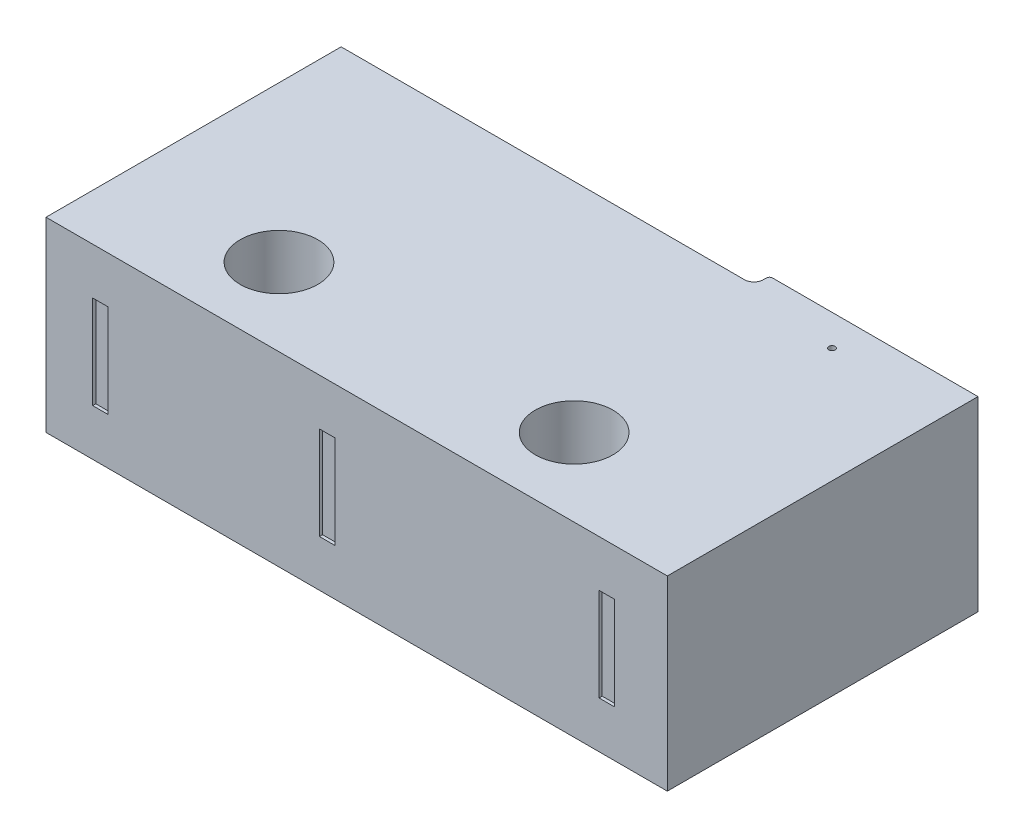
from build123d import *

# Parameters (mm, degrees)
SALIENTE_EXTRUIR2_DEPTH = 6
CROQUIS2_R              = 1.25
CORTAR_EXTRUIR1_DEPTH   = 10
REDONDEO1_R             = 0.1
CROQUIS3_W              = 2
CROQUIS3_H              = 3.3
CORTAR_EXTRUIR2_DEPTH   = 5
CROQUIS4_R              = 0.1
CORTAR_EXTRUIR3_DEPTH   = 6
CROQUIS5_W              = 0.5
CROQUIS5_H              = 3
CORTAR_EXTRUIR4_DEPTH   = 0.1


with BuildPart() as part:
    # Croquis1 → Saliente-Extruir2 (new body)
    with BuildSketch(Plane(origin=(0, 0, 0), x_dir=(1, 0, 0), z_dir=(0, 1, 0))):
        with BuildLine():
            Line((2.986733927, 4.5), (-10, 4.5))
            Line((-10, 4.5), (-10, -5))
            Line((-10, -5), (10, -5))
            Line((10, -5), (10, 5))
            Line((10, 5), (3.286733927, 5))
            Line((3.286733927, 5), (3.286733927, 4.8))
            ThreePointArc((3.286733927, 4.8), (3.198865961, 4.587867966), (2.986733927, 4.5))
        make_face()
    extrude(amount=SALIENTE_EXTRUIR2_DEPTH)

    # Croquis2 → Cortar-Extruir1 (cut)
    with BuildSketch(Plane(origin=(0, 6, 0), x_dir=(1, 0, 0), z_dir=(0, 1, 0))):
        with Locations(Location((-5, -2.5, 0), (0, 0, 270))):
            Circle(CROQUIS2_R)
        with Locations(Location((4.5, -2.5, 0), (0, 0, 270))):
            Circle(CROQUIS2_R)
    extrude(amount=-CORTAR_EXTRUIR1_DEPTH, mode=Mode.SUBTRACT)

    # Redondeo1
    redondeo1_edges = [part.edges().sort_by_distance(p)[0] for p in [
        (3.286733927, 3, -5),
    ]]
    fillet(redondeo1_edges, radius=REDONDEO1_R)

    # Croquis3 → Cortar-Extruir2 (cut)
    with BuildSketch(Plane(origin=(0, 0, -4.5), x_dir=(-1, 0, 0), z_dir=(0, 0, -1))):
        with Locations((-0.386733927, 3)):
            Rectangle(CROQUIS3_W, CROQUIS3_H)
    extrude(amount=-CORTAR_EXTRUIR2_DEPTH, mode=Mode.SUBTRACT)

    # Croquis4 → Cortar-Extruir3 (cut)
    with BuildSketch(Plane(origin=(0, 6, 0), x_dir=(1, 0, 0), z_dir=(0, 1, 0))):
        with Locations(Location((6.3, 4, 0), (0, 0, 270))):
            Circle(CROQUIS4_R)
    extrude(amount=-CORTAR_EXTRUIR3_DEPTH, mode=Mode.SUBTRACT)

    # Croquis5 → Cortar-Extruir4 (cut)
    with BuildSketch(Plane.XY.offset(5)):
        with Locations((-8.247200411, 3)):
            Rectangle(CROQUIS5_W, CROQUIS5_H)
        with Locations((-0.947200411, 3)):
            Rectangle(CROQUIS5_W, CROQUIS5_H)
        with Locations((8.052799589, 3)):
            Rectangle(CROQUIS5_W, CROQUIS5_H)
    extrude(amount=-CORTAR_EXTRUIR4_DEPTH, mode=Mode.SUBTRACT)


solid = part.part
